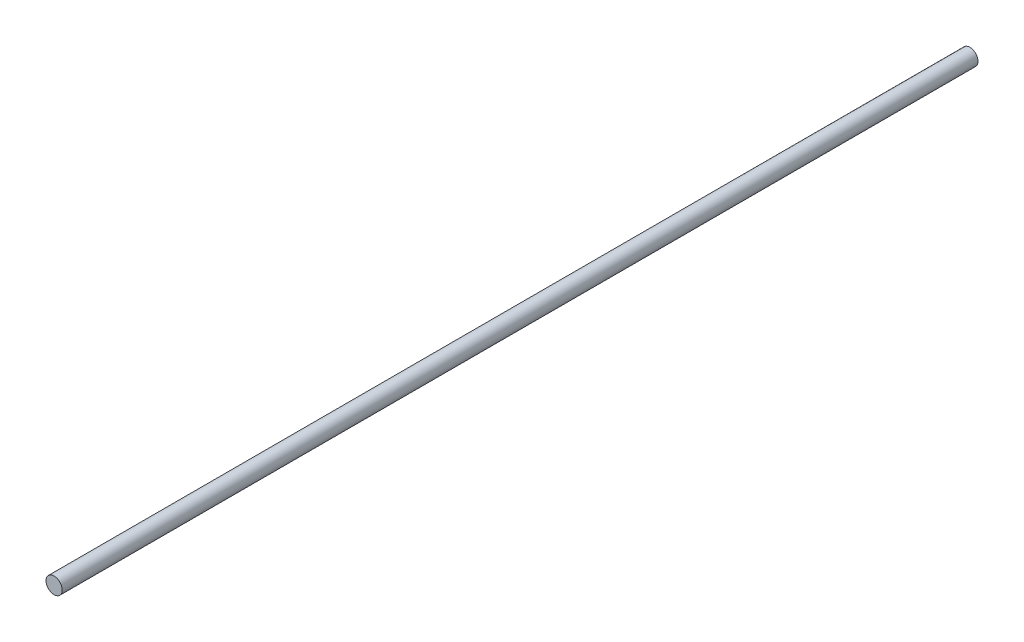
from build123d import *

# Parameters (mm, degrees)
SKETCH1_R           = 2
BOSS_EXTRUDE1_DEPTH = 113


with BuildPart() as part:
    # Sketch1 → Boss-Extrude1 (new, symmetric)
    with BuildSketch(Plane.XY):
        Circle(SKETCH1_R)
    extrude(amount=BOSS_EXTRUDE1_DEPTH, both=True)


solid = part.part
